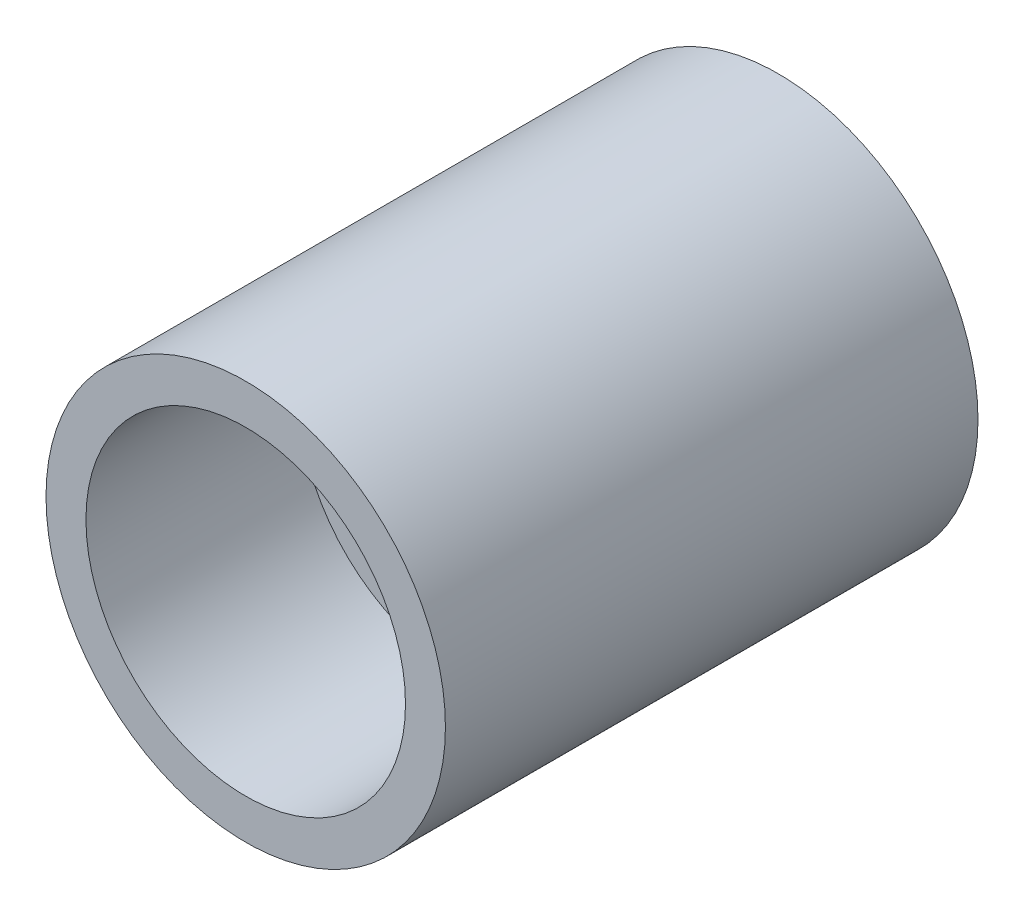
from build123d import *

# Parameters (mm, degrees)
SKETCH1_R           = 3.75
SKETCH1_R_2         = 3
BOSS_EXTRUDE1_DEPTH = 4
BOSS_EXTRUDE2_START = 6
SKETCH2_R           = 3.75
SKETCH2_R_2         = 1
BOSS_EXTRUDE2_DEPTH = 6
BOSS_EXTRUDE3_START = 1
SKETCH3_R           = 2
SKETCH3_R_2         = 1
BOSS_EXTRUDE3_DEPTH = 1


with BuildPart() as part:
    # Sketch1 → Boss-Extrude1 (new body)
    with BuildSketch(Plane.XY):
        Circle(SKETCH1_R)
        Circle(SKETCH1_R_2, mode=Mode.SUBTRACT)
    extrude(amount=BOSS_EXTRUDE1_DEPTH)

    # Sketch2 → Boss-Extrude2 (add)
    with BuildSketch(Plane(origin=(0, 0, 0), x_dir=(-1, 0, 0), z_dir=(0, 0, -1)).offset(BOSS_EXTRUDE2_START)):
        Circle(SKETCH2_R)
        Circle(SKETCH2_R_2, mode=Mode.SUBTRACT)
    extrude(amount=-BOSS_EXTRUDE2_DEPTH)

    # Sketch3 → Boss-Extrude3 (add)
    with BuildSketch(Plane(origin=(0, 0, -6), x_dir=(-1, 0, 0), z_dir=(0, 0, -1)).offset(BOSS_EXTRUDE3_START)):
        Circle(SKETCH3_R)
        Circle(SKETCH3_R_2, mode=Mode.SUBTRACT)
    extrude(amount=-BOSS_EXTRUDE3_DEPTH)


solid = part.part
